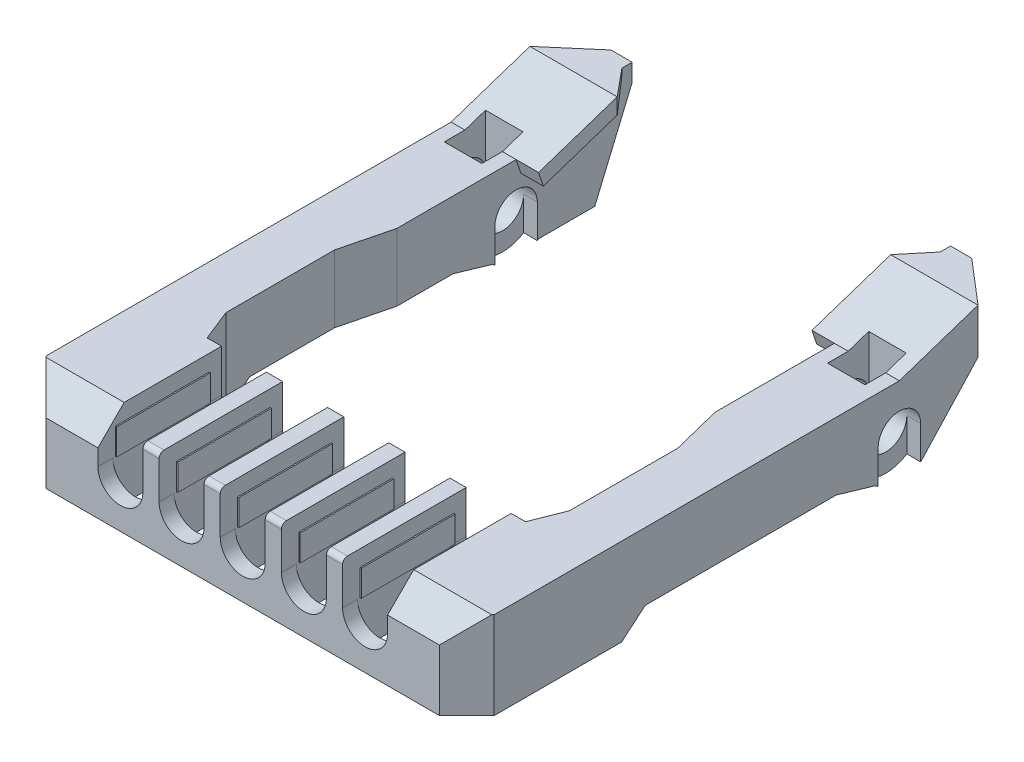
from build123d import *

# Parameters (mm, degrees)
SKETCH1_W                = 35.9
SKETCH1_H                = 9.9
BOSS_EXTRUDE1_DEPTH      = 7
CHAMFER1_SIZE            = 2.192031022
SKETCH2_W                = 3.6
SKETCH2_H                = 9.9
CUT_EXTRUDE1_DEPTH       = 3.4
CHAMFER2_SIZE            = 2.1
FILLET1_R                = 0.4
SKETCH3_R                = 1.8
CUT_EXTRUDE2_DEPTH       = 22.661313441
SKETCH4_W                = 7.5
SKETCH4_H                = 2.1
BOSS_EXTRUDE2_DEPTH      = 0.1
SKETCH5_W                = 7.5
SKETCH5_H                = 2.1
BOSS_EXTRUDE3_DEPTH      = 0.1
SKETCH6_W                = 7.5
SKETCH6_H                = 2.1
BOSS_EXTRUDE4_DEPTH      = 0.1
SKETCH7_W                = 7.5
SKETCH7_H                = 2.1
BOSS_EXTRUDE5_DEPTH      = 0.1
SKETCH8_W                = 7.5
SKETCH8_H                = 2.1
BOSS_EXTRUDE6_DEPTH      = 0.1
SKETCH9_W                = 7.5
SKETCH9_H                = 2.1
BOSS_EXTRUDE7_DEPTH      = 0.1
SKETCH10_W               = 7.5
SKETCH10_H               = 2.1
BOSS_EXTRUDE8_DEPTH      = 0.1
SKETCH11_W               = 7.5
SKETCH11_H               = 2.1
BOSS_EXTRUDE9_DEPTH      = 0.1
SKETCH12_W               = 7.5
SKETCH12_H               = 2.1
BOSS_EXTRUDE10_DEPTH     = 0.1
SKETCH13_W               = 7.5
SKETCH13_H               = 2.1
BOSS_EXTRUDE11_DEPTH     = 0.1
SKETCH14_W               = 5.2
SKETCH14_H               = 7
BOSS_EXTRUDE13_DEPTH     = 2.5
CUT_EXTRUDE4_DEPTH       = 21.656839061
SKETCH17_W               = 4.2
SKETCH17_H               = 7
BOSS_EXTRUDE15_DEPTH     = 1.9
CUT_EXTRUDE5_DEPTH       = 34.783316889
SKETCH20_W               = 4.2
SKETCH20_H               = 5.4
BOSS_EXTRUDE16_DEPTH     = 6.8
SKETCH21_W               = 5.2
SKETCH21_H               = 5.4
BOSS_EXTRUDE17_DEPTH     = 4
CUT_EXTRUDE6_DEPTH       = 28.878755352
SKETCH23_W               = 5.2
SKETCH23_H               = 5.4
BOSS_EXTRUDE18_DEPTH     = 4.5
SKETCH25_W               = 5.2
SKETCH25_H               = 6.4
BOSS_EXTRUDE19_DEPTH     = 3.4
CUT_EXTRUDE7_DEPTH       = 43.169805549
SKETCH27_W               = 5.2
SKETCH27_H               = 6.4
BOSS_EXTRUDE20_DEPTH     = 1.65
SKETCH28_W               = 5.2
SKETCH28_H               = 8.5
BOSS_EXTRUDE21_DEPTH     = 9.3
CUT_EXTRUDE8_DEPTH       = 51.460875934
SKETCH30_R               = 3.17
BOSS_EXTRUDE22_DEPTH     = 5.2
SKETCH31_R               = 1.7
CUT_EXTRUDE9_DEPTH       = 51.460875934
CUT_EXTRUDE10_DEPTH      = 1.1
SKETCH33_W               = 3.4
SKETCH33_H               = 3.840772379
CUT_EXTRUDE11_DEPTH      = 1.1
BOSS_EXTRUDE23_DEPTH     = 1.8
BOSS_EXTRUDE24_DEPTH     = 1.8
CUT_EXTRUDE12_DEPTH      = 44.886358928
CUT_EXTRUDE13_DEPTH      = 51.460875934
SKETCH38_W               = 3.6
SKETCH38_H               = 7.5
CUT_EXTRUDE14_DEPTH      = 3.6
CUT_EXTRUDE15_DEPTH      = 44.886358928
SKETCH43_W               = 2.8
SKETCH43_H               = 6.5
CUT_EXTRUDE16_DEPTH      = 6
CUT_EXTRUDE17_DEPTH      = 3
SKETCH45_W               = 4
SKETCH45_H               = 8.216346586
CUT_EXTRUDE19_DEPTH      = 38.685038028
CUT_EXTRUDE20_DEPTH      = 44.49945402
CUT_EXTRUDE20_DEPTH_BACK = 3.85
CUT_EXTRUDE21_DEPTH      = 5.9


with BuildPart() as part:
    # Sketch1 → Boss-Extrude1 (new body)
    with BuildSketch(Plane(origin=(0, 0, 0), x_dir=(1, 0, 0), z_dir=(0, 1, 0))):
        Rectangle(SKETCH1_W, SKETCH1_H)
    extrude(amount=BOSS_EXTRUDE1_DEPTH)

    # Chamfer1
    chamfer1_edges = [part.edges().sort_by_distance(p)[0] for p in [
        (-17.95, 3.5, 4.95),
        (17.95, 3.5, 4.95),
    ]]
    chamfer(chamfer1_edges, length=CHAMFER1_SIZE)

    # Sketch2 → Cut-Extrude1 (cut)
    with BuildSketch(Plane(origin=(0, 7, 0), x_dir=(1, 0, 0), z_dir=(0, 1, 0))):
        with Locations((9.8, 0)):
            Rectangle(SKETCH2_W, SKETCH2_H)
        with Locations((4.9, 0)):
            Rectangle(SKETCH2_W, SKETCH2_H)
        Rectangle(SKETCH2_W, SKETCH2_H)
        with Locations((-4.9, 0)):
            Rectangle(SKETCH2_W, SKETCH2_H)
        with Locations((-9.8, 0)):
            Rectangle(SKETCH2_W, SKETCH2_H)
    extrude(amount=-CUT_EXTRUDE1_DEPTH, mode=Mode.SUBTRACT)

    # Chamfer2
    chamfer2_edges = [part.edges().sort_by_distance(p)[0] for p in [
        (-13.678984489, 7, 4.95),
        (13.678984489, 7, 4.95),
    ]]
    chamfer(chamfer2_edges, length=CHAMFER2_SIZE)

    # Fillet1
    fillet1_edges = [part.edges().sort_by_distance(p)[0] for p in [
        (-7.35, 7, 4.95),
        (-2.45, 7, 4.95),
        (2.45, 7, 4.95),
        (7.35, 7, 4.95),
    ]]
    fillet(fillet1_edges, radius=FILLET1_R)

    # Sketch3 → Cut-Extrude2 (cut, through all)
    with BuildSketch(Plane.XY.offset(4.95)):
        with Locations((9.8, 3.6)):
            Circle(SKETCH3_R)
        with Locations((4.9, 3.6)):
            Circle(SKETCH3_R)
        with Locations((0, 3.6)):
            Circle(SKETCH3_R)
        with Locations((-4.9, 3.6)):
            Circle(SKETCH3_R)
        with Locations((-9.8, 3.6)):
            Circle(SKETCH3_R)
    extrude(amount=-CUT_EXTRUDE2_DEPTH, mode=Mode.SUBTRACT)

    # Sketch4 → Boss-Extrude2 (add)
    with BuildSketch(Plane(origin=(-6.7, 0, 0), x_dir=(0, 0, -1), z_dir=(1, 0, 0))):
        with Locations((0.2, 4.65)):
            Rectangle(SKETCH4_W, SKETCH4_H)
    extrude(amount=BOSS_EXTRUDE2_DEPTH)

    # Sketch5 → Boss-Extrude3 (add)
    with BuildSketch(Plane(origin=(-1.8, 0, 0), x_dir=(0, 0, -1), z_dir=(1, 0, 0))):
        with Locations((0.2, 4.65)):
            Rectangle(SKETCH5_W, SKETCH5_H)
    extrude(amount=BOSS_EXTRUDE3_DEPTH)

    # Sketch6 → Boss-Extrude4 (add)
    with BuildSketch(Plane(origin=(3.1, 0, 0), x_dir=(0, 0, -1), z_dir=(1, 0, 0))):
        with Locations((0.2, 4.65)):
            Rectangle(SKETCH6_W, SKETCH6_H)
    extrude(amount=BOSS_EXTRUDE4_DEPTH)

    # Sketch7 → Boss-Extrude5 (add)
    with BuildSketch(Plane(origin=(8, 0, 0), x_dir=(0, 0, -1), z_dir=(1, 0, 0))):
        with Locations((0.2, 4.65)):
            Rectangle(SKETCH7_W, SKETCH7_H)
    extrude(amount=BOSS_EXTRUDE5_DEPTH)

    # Sketch8 → Boss-Extrude6 (add)
    with BuildSketch(Plane(origin=(-11.6, 0, 0), x_dir=(0, 0, -1), z_dir=(1, 0, 0))):
        with Locations((0.2, 4.65)):
            Rectangle(SKETCH8_W, SKETCH8_H)
    extrude(amount=BOSS_EXTRUDE6_DEPTH)

    # Sketch9 → Boss-Extrude7 (add)
    with BuildSketch(Plane.ZY.offset(8)):
        with Locations((-0.2, 4.65)):
            Rectangle(SKETCH9_W, SKETCH9_H)
    extrude(amount=BOSS_EXTRUDE7_DEPTH)

    # Sketch10 → Boss-Extrude8 (add)
    with BuildSketch(Plane.ZY.offset(3.1)):
        with Locations((-0.2, 4.65)):
            Rectangle(SKETCH10_W, SKETCH10_H)
    extrude(amount=BOSS_EXTRUDE8_DEPTH)

    # Sketch11 → Boss-Extrude9 (add)
    with BuildSketch(Plane.ZY.offset(-1.8)):
        with Locations((-0.2, 4.65)):
            Rectangle(SKETCH11_W, SKETCH11_H)
    extrude(amount=BOSS_EXTRUDE9_DEPTH)

    # Sketch12 → Boss-Extrude10 (add)
    with BuildSketch(Plane.ZY.offset(-6.7)):
        with Locations((-0.2, 4.65)):
            Rectangle(SKETCH12_W, SKETCH12_H)
    extrude(amount=BOSS_EXTRUDE10_DEPTH)

    # Sketch13 → Boss-Extrude11 (add)
    with BuildSketch(Plane.ZY.offset(-11.6)):
        with Locations((-0.2, 4.65)):
            Rectangle(SKETCH13_W, SKETCH13_H)
    extrude(amount=BOSS_EXTRUDE11_DEPTH)

    # Sketch14 → Boss-Extrude13 (add)
    with BuildSketch(Plane(origin=(0, 0, -4.95), x_dir=(-1, 0, 0), z_dir=(0, 0, -1))):
        with Locations((15.35, 3.5)):
            Rectangle(SKETCH14_W, SKETCH14_H)
    extrude(amount=BOSS_EXTRUDE13_DEPTH)

    # Sketch16 → Cut-Extrude4 (cut, through all)
    with BuildSketch(Plane(origin=(0, 7, 0), x_dir=(1, 0, 0), z_dir=(0, 1, 0))):
        Polygon((-12.75, 7.45), (-13.75, 7.45), (-12.75, 4.95), align=None)
    extrude(amount=-CUT_EXTRUDE4_DEPTH, mode=Mode.SUBTRACT)

    # Sketch17 → Boss-Extrude15 (add)
    with BuildSketch(Plane(origin=(0, 0, -7.45), x_dir=(-1, 0, 0), z_dir=(0, 0, -1))):
        with Locations((15.85, 3.5)):
            Rectangle(SKETCH17_W, SKETCH17_H)
    extrude(amount=BOSS_EXTRUDE15_DEPTH)

    # Sketch19 → Cut-Extrude5 (cut, through all)
    with BuildSketch(Plane(origin=(-13.75, 0, 0), x_dir=(0, 0, -1), z_dir=(1, 0, 0))):
        Polygon((9.35, 1.6), (7.45, 0), (9.35, 0), align=None)
    extrude(amount=-CUT_EXTRUDE5_DEPTH, mode=Mode.SUBTRACT)

    # Sketch20 → Boss-Extrude16 (add)
    with BuildSketch(Plane(origin=(0, 0, -9.35), x_dir=(-1, 0, 0), z_dir=(0, 0, -1))):
        with Locations((15.85, 4.3)):
            Rectangle(SKETCH20_W, SKETCH20_H)
    extrude(amount=BOSS_EXTRUDE16_DEPTH)

    # Sketch21 → Boss-Extrude17 (add)
    with BuildSketch(Plane(origin=(0, 0, -16.15), x_dir=(-1, 0, 0), z_dir=(0, 0, -1))):
        with Locations((15.35, 4.3)):
            Rectangle(SKETCH21_W, SKETCH21_H)
    extrude(amount=BOSS_EXTRUDE17_DEPTH)

    # Sketch22 → Cut-Extrude6 (cut, through all)
    with BuildSketch(Plane(origin=(0, 7, 0), x_dir=(1, 0, 0), z_dir=(0, 1, 0))):
        Polygon((-12.75, 20.15), (-13.75, 16.15), (-12.75, 16.15), align=None)
    extrude(amount=-CUT_EXTRUDE6_DEPTH, mode=Mode.SUBTRACT)

    # Sketch23 → Boss-Extrude18 (add)
    with BuildSketch(Plane(origin=(0, 0, -20.15), x_dir=(-1, 0, 0), z_dir=(0, 0, -1))):
        with Locations((15.35, 4.3)):
            Rectangle(SKETCH23_W, SKETCH23_H)
    extrude(amount=BOSS_EXTRUDE18_DEPTH)

    # Sketch25 → Boss-Extrude19 (add)
    with BuildSketch(Plane(origin=(0, 0, -24.65), x_dir=(-1, 0, 0), z_dir=(0, 0, -1))):
        with Locations((15.35, 3.8)):
            Rectangle(SKETCH25_W, SKETCH25_H)
    extrude(amount=BOSS_EXTRUDE19_DEPTH)

    # Sketch26 → Cut-Extrude7 (cut, through all)
    with BuildSketch(Plane(origin=(-12.75, 0, 0), x_dir=(0, 0, -1), z_dir=(1, 0, 0))):
        Polygon((24.65, 1.6), (28.05, 0.6), (24.65, 0.6), align=None)
    extrude(amount=-CUT_EXTRUDE7_DEPTH, mode=Mode.SUBTRACT)

    # Sketch27 → Boss-Extrude20 (add)
    with BuildSketch(Plane(origin=(0, 0, -28.05), x_dir=(-1, 0, 0), z_dir=(0, 0, -1))):
        with Locations((15.35, 3.8)):
            Rectangle(SKETCH27_W, SKETCH27_H)
    extrude(amount=BOSS_EXTRUDE20_DEPTH)

    # Sketch28 → Boss-Extrude21 (add)
    with BuildSketch(Plane(origin=(0, 0, -29.7), x_dir=(-1, 0, 0), z_dir=(0, 0, -1))):
        with Locations((15.35, 4.85)):
            Rectangle(SKETCH28_W, SKETCH28_H)
    extrude(amount=BOSS_EXTRUDE21_DEPTH)

    # Sketch29 → Cut-Extrude8 (cut, through all)
    with BuildSketch(Plane(origin=(-12.75, 0, 0), x_dir=(0, 0, -1), z_dir=(1, 0, 0))):
        Polygon((36, 9.1), (29.7, 7), (29.7, 9.1), align=None)
    extrude(amount=-CUT_EXTRUDE8_DEPTH, mode=Mode.SUBTRACT)

    # Sketch30 → Boss-Extrude22 (add, through all)
    with BuildSketch(Plane(origin=(-12.75, 0, 0), x_dir=(0, 0, -1), z_dir=(1, 0, 0))):
        with Locations((29.7, 3.2)):
            Circle(SKETCH30_R)
    extrude(amount=-BOSS_EXTRUDE22_DEPTH)

    # Sketch31 → Cut-Extrude9 (cut, through all)
    with BuildSketch(Plane(origin=(-12.75, 0, 0), x_dir=(0, 0, -1), z_dir=(1, 0, 0))):
        with Locations((29.7, 3.2)):
            Circle(SKETCH31_R)
    extrude(amount=-CUT_EXTRUDE9_DEPTH, mode=Mode.SUBTRACT)

    # Sketch32 → Cut-Extrude10 (cut)
    with BuildSketch(Plane(origin=(-12.75, 0, 0), x_dir=(0, 0, -1), z_dir=(1, 0, 0))):
        Polygon((29.7, 3.2), (28, 3.2), (28, 0.52438792), (28, -0.120840115), (31.4, -0.120840115), (31.4, 0.52438792), (31.4, 3.2), align=None)
    extrude(amount=-CUT_EXTRUDE10_DEPTH, mode=Mode.SUBTRACT)

    # Sketch33 → Cut-Extrude11 (cut)
    with BuildSketch(Plane.ZY.offset(17.95)):
        with Locations((-29.7, 1.279613811)):
            Rectangle(SKETCH33_W, SKETCH33_H)
    extrude(amount=-CUT_EXTRUDE11_DEPTH, mode=Mode.SUBTRACT)

    # Sketch34 → Boss-Extrude23 (add)
    with BuildSketch(Plane(origin=(-12.75, 0, 0), x_dir=(0, 0, -1), z_dir=(1, 0, 0))):
        Polygon((29.7, 7), (30.079473319, 5.861580042), (36, 7.835088936), (36, 9.1), align=None)
    extrude(amount=BOSS_EXTRUDE23_DEPTH)

    # Sketch35 → Boss-Extrude24 (add)
    with BuildSketch(Plane(origin=(-12.75, 0, 0), x_dir=(0, 0, -1), z_dir=(1, 0, 0))):
        Polygon((36, 7.835088936), (38.172140755, 8.559135854), (38.172140755, 9.1), (36, 9.1), align=None)
    extrude(amount=BOSS_EXTRUDE24_DEPTH)

    # Sketch36 → Cut-Extrude12 (cut, through all)
    with BuildSketch(Plane(origin=(0, 9.1, 0), x_dir=(1, 0, 0), z_dir=(0, 1, 0))):
        Polygon((-10.95, 36), (-12.75, 38.172140755), (-10.95, 38.172140755), align=None)
    extrude(amount=-CUT_EXTRUDE12_DEPTH, mode=Mode.SUBTRACT)

    # Sketch37 → Cut-Extrude13 (cut, through all)
    with BuildSketch(Plane(origin=(-12.75, 0, 0), x_dir=(0, 0, -1), z_dir=(1, 0, 0))):
        Polygon((39, 7.7), (36, 0.6), (39, 0.6), align=None)
    extrude(amount=-CUT_EXTRUDE13_DEPTH, mode=Mode.SUBTRACT)

    # Sketch38 → Cut-Extrude14 (cut)
    with BuildSketch(Plane.XZ):
        with Locations((9.8, 0)):
            Rectangle(SKETCH38_W, SKETCH38_H)
        with Locations((4.9, 0)):
            Rectangle(SKETCH38_W, SKETCH38_H)
        Rectangle(SKETCH38_W, SKETCH38_H)
        with Locations((-4.9, 0)):
            Rectangle(SKETCH38_W, SKETCH38_H)
        with Locations((-9.8, 0)):
            Rectangle(SKETCH38_W, SKETCH38_H)
    extrude(amount=-CUT_EXTRUDE14_DEPTH, mode=Mode.SUBTRACT)

    # Sketch39 → Cut-Extrude15 (cut, through all)
    with BuildSketch(Plane(origin=(0, 9.1, 0), x_dir=(1, 0, 0), z_dir=(0, 1, 0))):
        Polygon((-14.45, 39), (-17.95, 36), (-17.95, 39), align=None)
    extrude(amount=-CUT_EXTRUDE15_DEPTH, mode=Mode.SUBTRACT)

    # Sketch43 → Cut-Extrude16 (cut)
    with BuildSketch(Plane.XZ.offset(-0.6)):
        with Locations((-15.35, -35.75)):
            Rectangle(SKETCH43_W, SKETCH43_H)
    extrude(amount=-CUT_EXTRUDE16_DEPTH, mode=Mode.SUBTRACT)

    # Sketch44 → Cut-Extrude17 (cut)
    with BuildSketch(Plane.ZY.offset(17.95)):
        Polygon((-37.028571429, 6.6), (-31.457172983, 0.561583219), (-36.715678701, 0.561583219), align=None)
    extrude(amount=-CUT_EXTRUDE17_DEPTH, mode=Mode.SUBTRACT)


with BuildPart() as cut_extrude17_piece_1:
    # of the separate pieces the step leaves, piece 1, a body of its own (cut_extrude17_pieces)
    add(part.part.solids().sort_by_distance((6.7, 6.6, 4.95))[0])


with BuildPart() as cut_extrude17_piece_2:
    # of the separate pieces the step leaves, piece 2, a body of its own (cut_extrude17_pieces)
    add(part.part.solids().sort_by_distance((-16.995688436, 2.535889172, -36.81798134))[0])


with BuildPart() as cut_extrude19_tool:
    # Sketch45 → Cut-Extrude19 (new, through all)
    with BuildSketch(Plane(origin=(0, -15.419528714, -16.712059251), x_dir=(-1, 0, 0), z_dir=(0, -0.6781141661041539, -0.7349565822066416))):
        with Locations((15.95, 25.852467202)):
            Rectangle(SKETCH45_W, SKETCH45_H)
    extrude(amount=CUT_EXTRUDE19_DEPTH)


with BuildPart() as cut_extrude17_piece_1_1:
    add(cut_extrude17_piece_1.part)

    # Cut-Extrude19: cut by cut_extrude19_tool
    add(cut_extrude19_tool.part, mode=Mode.SUBTRACT)

    # Sketch47 → Cut-Extrude20 (cut, two sides: drawn at the far end of the back side and taken through both)
    with BuildSketch(Plane(origin=(0, 7, 0), x_dir=(1, 0, 0), z_dir=(0, 1, 0)).offset(-CUT_EXTRUDE20_DEPTH_BACK)):
        Polygon((-16.85, 29.7), (-16.85, 28.05), (-13.85, 28.05), (-13.85, 29.7), (-13.85, 31.35), (-16.85, 31.35), align=None)
    extrude(amount=CUT_EXTRUDE20_DEPTH + CUT_EXTRUDE20_DEPTH_BACK, mode=Mode.SUBTRACT)

    # Mirror1: Cut-Extrude17 piece 1 across plane


with BuildPart() as cut_extrude17_piece_2_1:
    add(cut_extrude17_piece_2.part)

    # Cut-Extrude19: cut by cut_extrude19_tool
    add(cut_extrude19_tool.part, mode=Mode.SUBTRACT)


with BuildPart() as cut_extrude17_piece_1_2:
    add(cut_extrude17_piece_1_1.part)
    add(cut_extrude17_piece_1_1.part.mirror(Plane(origin=(0, 0, 0), x_dir=(0, 0, 1), z_dir=(1, 0, 0))))

    # Sketch49 → Cut-Extrude21 (cut)
    with BuildSketch(Plane.XZ):
        Polygon((-14.95, -9.35), (-14.95, -7.45), (-14.95, -7.218901116), (-14.864172029, -7.004331188), (-13.864172029, -4.504331188), (-13.576782584, -3.75), (-12.8, -3.75), (-12.8, 3.75), (-15.260912703, 3.75), (-16.75, 2.260912703), (-16.75, -7.45), (-16.75, -9.35), (-16.75, -24.65), (-13.95, -24.65), (-13.95, -20.297726751), (-14.95, -16.297726751), align=None)
    cut_extrude21 = extrude(amount=-CUT_EXTRUDE21_DEPTH, mode=Mode.SUBTRACT)

    # Mirror2: Cut-Extrude21 across plane
    add(cut_extrude21.mirror(Plane(origin=(0, 0, 0), x_dir=(0, 0, 1), z_dir=(1, 0, 0))), mode=Mode.SUBTRACT)


solid = cut_extrude17_piece_1_2.part
